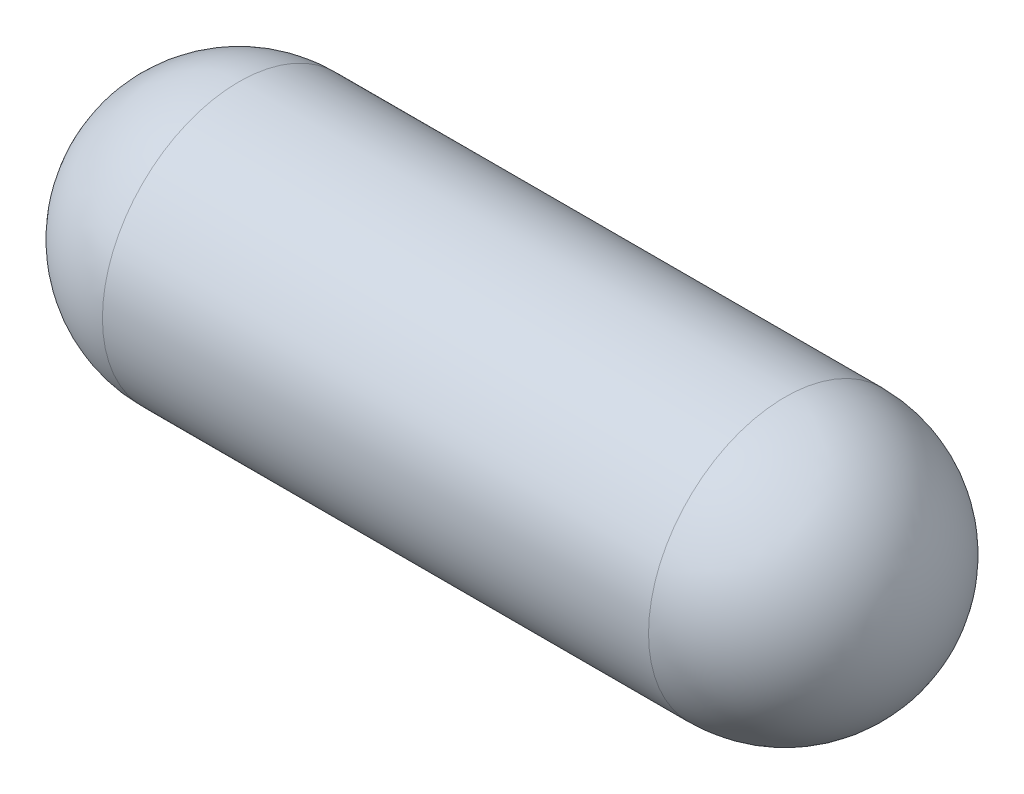
from build123d import *


with BuildPart() as part:
    # Sketch1 → Revolve1 (revolve)
    with BuildSketch(Plane.XY, mode=Mode.PRIVATE) as revolve1_sk:
        with BuildLine():
            Line((3.175, 1.5875), (-3.175, 1.5875))
            ThreePointArc((-3.175, 1.5875), (-4.297532015, 1.122532015), (-4.7625, 0))
            Line((-4.7625, 0), (4.7625, 0))
            ThreePointArc((4.7625, 0), (4.297532015, 1.122532015), (3.175, 1.5875))
        make_face()
    revolve(revolve1_sk.sketch.rotate(Axis((-14.084204025, 0, 0), (1, 0, 0)), 90), axis=Axis((-14.084204025, 0, 0), (1, 0, 0)))


solid = part.part
